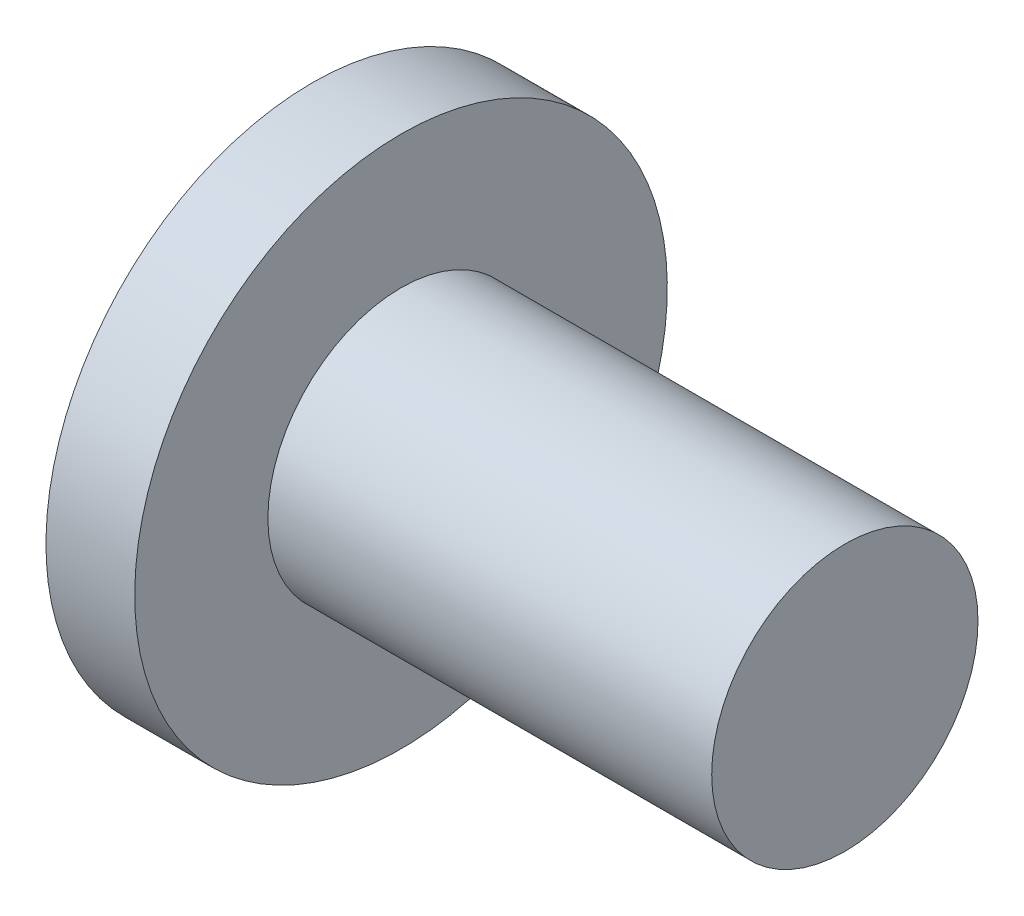
from build123d import *


with BuildPart() as part:
    # Sketch1 → Revolve1 (revolve)
    with BuildSketch(Plane.XY):
        Polygon((0, 0), (-12, 0), (-12, 6), (-10, 6), (-10, 3), (0, 3), align=None)
    revolve(axis=Axis((0, 0, 0), (-1, 0, 0)))


solid = part.part
